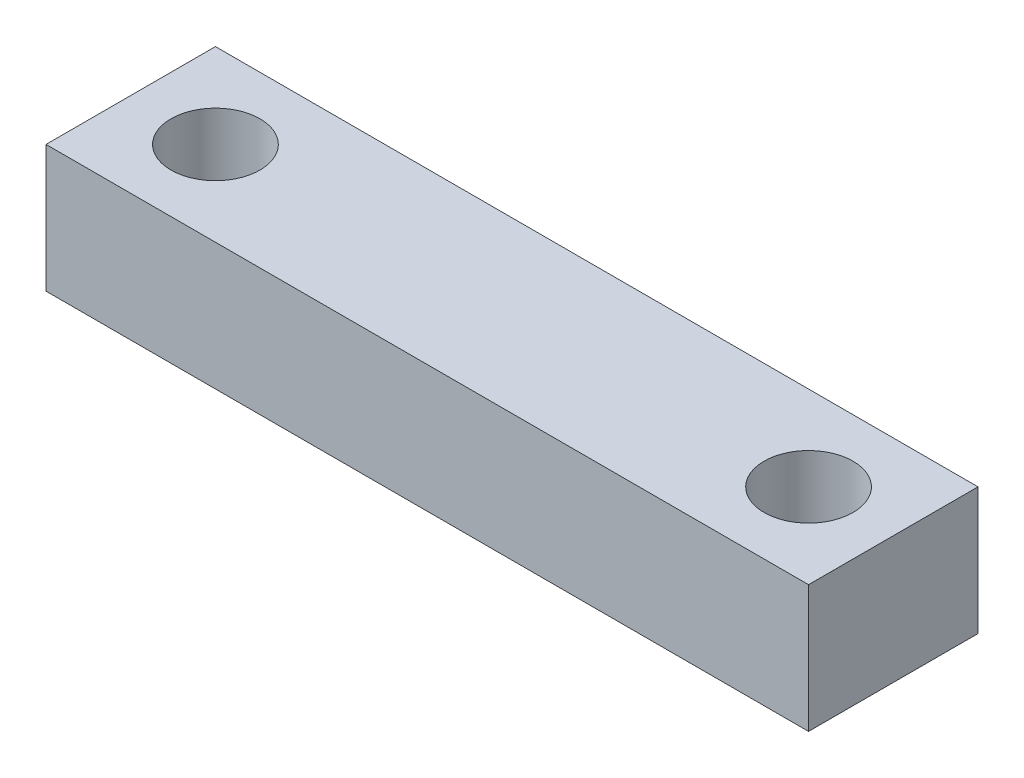
from build123d import *

# Parameters (mm, degrees)
SKETCH1_W           = 36
SKETCH1_H           = 8
SKETCH1_R           = 2.1
BOSS_EXTRUDE1_DEPTH = 6


with BuildPart() as part:
    # Sketch1 → Boss-Extrude1 (new body)
    with BuildSketch(Plane(origin=(0, 0, 0), x_dir=(1, 0, 0), z_dir=(0, 1, 0))):
        with Locations((18, -4)):
            Rectangle(SKETCH1_W, SKETCH1_H)
        with Locations(Location((4, -4, 0), (0, 0, 270))):
            Circle(SKETCH1_R, mode=Mode.SUBTRACT)
        with Locations(Location((32, -4, 0), (0, 0, 90))):
            Circle(SKETCH1_R, mode=Mode.SUBTRACT)
    extrude(amount=BOSS_EXTRUDE1_DEPTH)


solid = part.part
